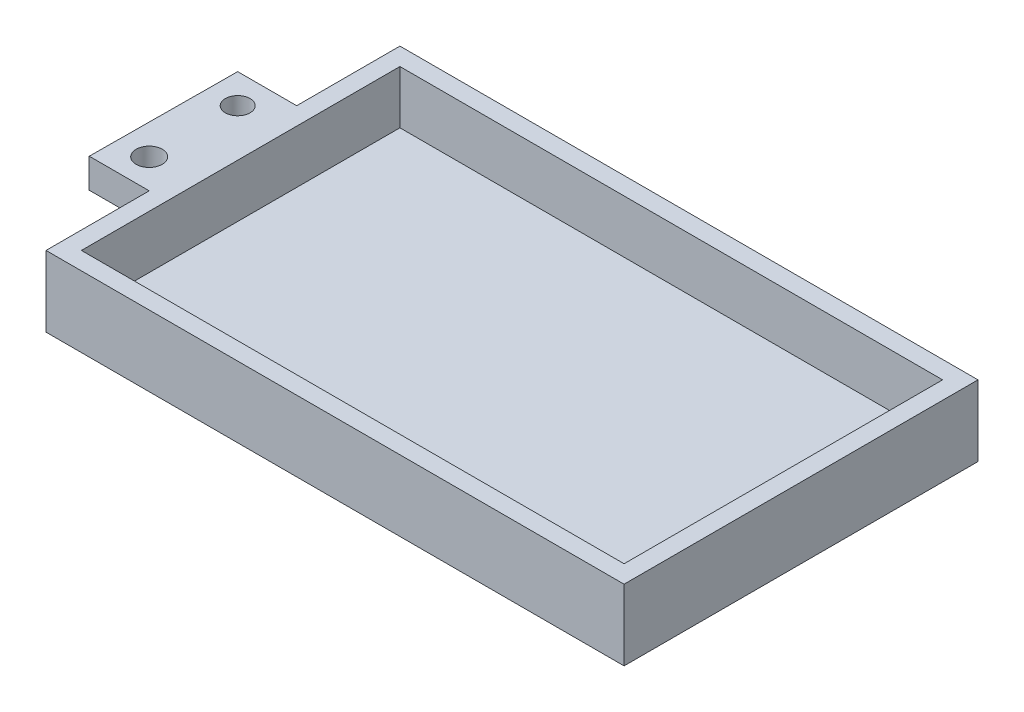
from build123d import *

# Parameters (mm, degrees)
SKETCH_1_R          = 2.1
SKETCH_1_R_2        = 2.220092539
EXTRUDE_1_DEPTH     = 12
SKETCH_2_W          = 92
SKETCH_2_H          = 54
CUT_EXTRUDE_1_DEPTH = 9
SKETCH_3_W          = 10.168078989
SKETCH_3_H          = 25
CUT_EXTRUDE_2_DEPTH = 7
RIB_1_REACH         = 69.416
SKETCH_5_WALL_W     = 145.707888858
SKETCH_5_WALL_H     = 5


with BuildPart() as part:
    # 草图1 → 凸台-拉伸1 (new body)
    with BuildSketch(Plane(origin=(0, 0, 0), x_dir=(1, 0, 0), z_dir=(0, 1, 0))):
        Polygon((49, -30), (-49, -30), (-49, -12.5), (-59.168078989, -12.5), (-59, 12.5), (-49, 12.5), (-49, 30), (49, 30), align=None)
        with Locations(Location((-54, 7.5, 0), (0, 0, 270))):
            Circle(SKETCH_1_R, mode=Mode.SUBTRACT)
        with Locations(Location((-54, -7.5, 0), (0, 0, 270))):
            Circle(SKETCH_1_R_2, mode=Mode.SUBTRACT)
    extrude(amount=EXTRUDE_1_DEPTH)

    # 草图2 → 切除-拉伸1 (cut)
    with BuildSketch(Plane(origin=(0, 12, 0), x_dir=(1, 0, 0), z_dir=(0, 1, 0))):
        Rectangle(SKETCH_2_W, SKETCH_2_H)
    extrude(amount=-CUT_EXTRUDE_1_DEPTH, mode=Mode.SUBTRACT)

    # 草图3 → 切除-拉伸2 (cut)
    with BuildSketch(Plane.XZ):
        with Locations((-54.084039495, 0)):
            Rectangle(SKETCH_3_W, SKETCH_3_H)
    extrude(amount=-CUT_EXTRUDE_2_DEPTH, mode=Mode.SUBTRACT)

    # 草图5 wall → 筋1 (add, up to next)
    with BuildSketch(Plane(origin=(-52.61004627, 4.418029941, 0), x_dir=(0.813374663447, -0.581740197049, 0), z_dir=(0.581740197049, 0.813374663447, 0)), mode=Mode.PRIVATE) as rib_1_sk1:
        Rectangle(SKETCH_5_WALL_W, SKETCH_5_WALL_H)
    rib_1_tool1 = extrude(rib_1_sk1.sketch, amount=RIB_1_REACH, mode=Mode.PRIVATE) - part.part
    add(rib_1_tool1.solids().sort_by_distance((-52.61004627, 4.418029941, 0))[0])


solid = part.part
